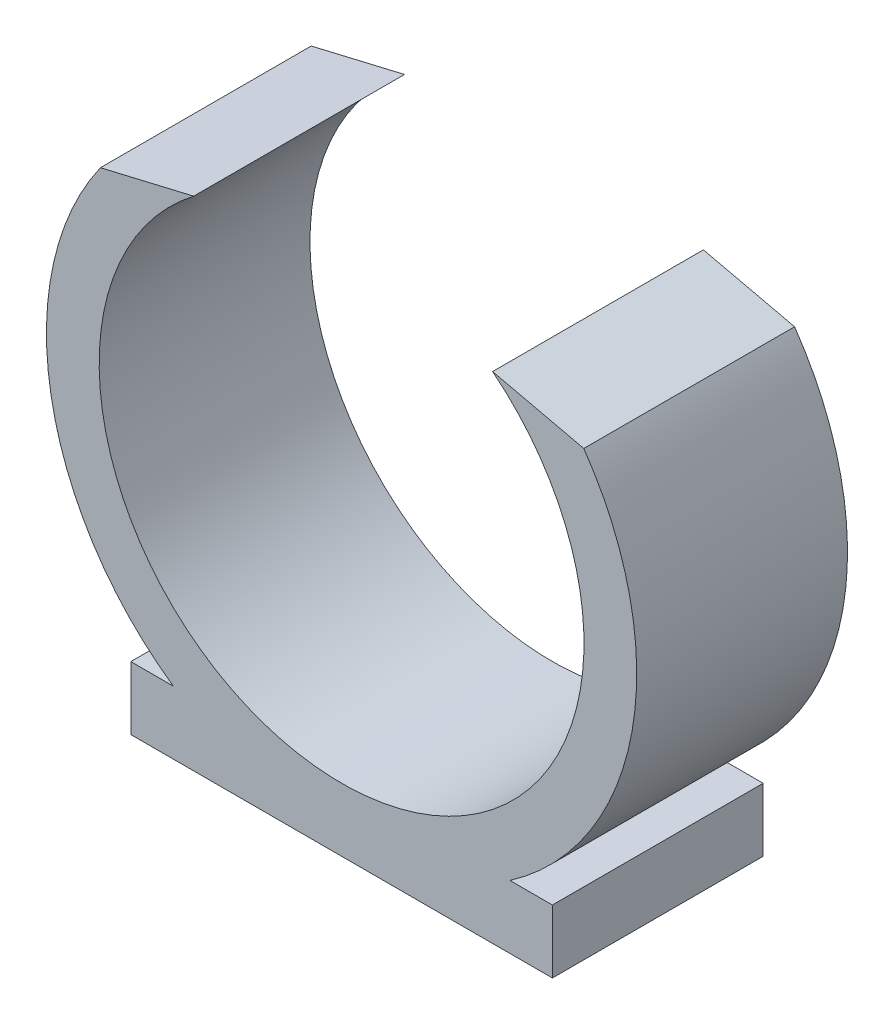
from build123d import *

# Parameters (mm, degrees)
EXTRUDE_1_DEPTH = 5


with BuildPart() as part:
    # 草图1 → 凸台-拉伸1 (new body)
    with BuildSketch(Plane.XY):
        with BuildLine():
            Line((8.992179856, 1.5), (10, 1.5))
            Line((10, 1.5), (10, 0))
            Line((10, 0), (0, 0))
            Line((0, 0), (0, 1.5))
            Line((0, 1.5), (1.007820144, 1.5))
            ThreePointArc((1.007820144, 1.5), (-1.893270413, 6.032287794), (-0.720584593, 11.284217633))
            Line((-0.720584593, 11.284217633), (1.492224546, 11.806096066))
            ThreePointArc((1.492224546, 11.806096066), (4.953081958, 1.500191421), (8.581658268, 11.748246776))
            Line((8.581658268, 11.748246776), (10.744690333, 11.249816618))
            ThreePointArc((10.744690333, 11.249816618), (11.889585712, 6.011610437), (8.992179856, 1.5))
        make_face()
    extrude(amount=EXTRUDE_1_DEPTH)


solid = part.part
